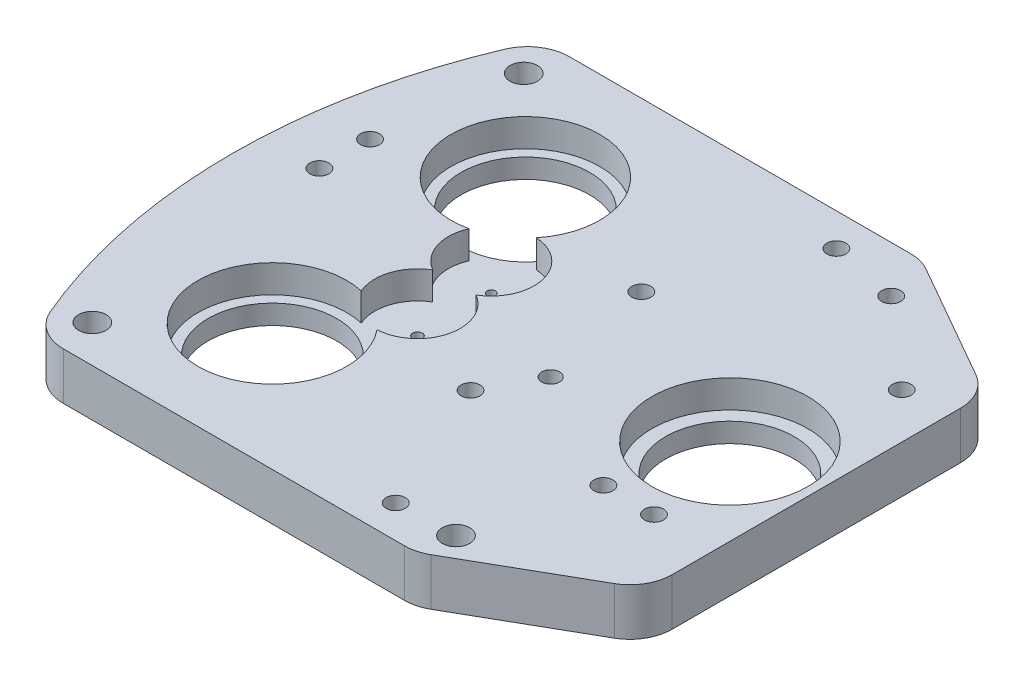
from build123d import *

# Parameters (mm, degrees)
SKETCH1_W                        = 125
SKETCH1_H                        = 120
TEST_BASE_POSTION_DEPTH          = 11.215
SKETCH10_R                       = 15.25
CONNECT_FINGER_HOLES_DEPTH       = 98.597363925
SKETCH11_R                       = 18.5
XL320_FINGER_KNUCKLE_MOUNT_DEPTH = 6.6025
SKETCH24_R                       = 2.25
AX12_MOUNT_HOLES_M4_DEPTH        = 98.597363925
SKETCH21_R                       = 17.65
SKETCH21_R_2                     = 10.15
GEARS_HOLES_DEPTH                = 6.6025
SKETCH22_R                       = 1.15
GEARS_ROD_HOLES_DEPTH            = 3
CUT_EXTRUDE1_DEPTH               = 98.597363925
FILLET1_R                        = 10
SKETCH17_R                       = 3.25
CONNECT_HOLES_M6_DEPTH           = 98.597363925
NUTS_M6_DEPTH                    = 6
NUTS_M4_DEPTH                    = 5
SKETCH30_R                       = 2.1
CONNECT_TO_HOUSE_DEPTH           = 98.597363925
SKETCH31_R                       = 2.25
M4_EXTENSION_HOLE_DEPTH          = 5
SKETCH28_R                       = 1
M2_SHAFT_HOLE_DEPTH              = 3


with BuildPart() as part:
    # Sketch1 → Test_Base_Postion (new body)
    with BuildSketch(Plane(origin=(0, 0, 0), x_dir=(1, 0, 0), z_dir=(0, 1, 0))):
        with BuildLine():
            ThreePointArc((-62.5, 60), (-76.154246239, 0), (-62.5, -60))
            Line((-62.5, -60), (-62.5, 60))
        make_face()
        Rectangle(SKETCH1_W, SKETCH1_H)
    extrude(amount=TEST_BASE_POSTION_DEPTH)

    # Sketch10 → Connect_Finger_Holes (cut, through all)
    with BuildSketch(Plane(origin=(0, 11.215, 0), x_dir=(1, 0, 0), z_dir=(0, 1, 0))):
        with Locations(Location((-36.5, 30, 0), (0, 0, 270))):
            Circle(SKETCH10_R)
        with Locations(Location((-36.5, -30, 0), (0, 0, 270))):
            Circle(SKETCH10_R)
        with Locations(Location((42, 0, 0), (0, 0, 270))):
            Circle(SKETCH10_R)
    extrude(amount=-CONNECT_FINGER_HOLES_DEPTH, mode=Mode.SUBTRACT)

    # Sketch11 → XL320_Finger_Knuckle_Mount (cut)
    with BuildSketch(Plane(origin=(0, 11.215, 0), x_dir=(1, 0, 0), z_dir=(0, 1, 0))):
        with Locations(Location((42, 0, 0), (0, 0, 270))):
            Circle(SKETCH11_R)
    extrude(amount=-XL320_FINGER_KNUCKLE_MOUNT_DEPTH, mode=Mode.SUBTRACT)

    # Sketch24 → AX12_Mount_Holes_(M4) (cut, through all)
    with BuildSketch(Plane(origin=(0, 11.215, 0), x_dir=(1, 0, 0), z_dir=(0, 1, 0))):
        with Locations(Location((15, 52.25, 0), (0, 0, 270))):
            Circle(SKETCH24_R)
        with Locations(Location((0.75, 20.25, 0), (0, 0, 270))):
            Circle(SKETCH24_R)
        with Locations(Location((0.75, -20.25, 0), (0, 0, 270))):
            Circle(SKETCH24_R)
        with Locations(Location((15, -52.25, 0), (0, 0, 270))):
            Circle(SKETCH24_R)
        with Locations(Location((51.75, 31, 0), (0, 0, 270))):
            Circle(SKETCH24_R)
        with Locations(Location((31.25, 49, 0), (0, 0, 270))):
            Circle(SKETCH24_R)
    extrude(amount=-AX12_MOUNT_HOLES_M4_DEPTH, mode=Mode.SUBTRACT)

    # Sketch21 → Gears_Holes (cut)
    with BuildSketch(Plane(origin=(0, 11.215, 0), x_dir=(1, 0, 0), z_dir=(0, 1, 0))):
        with Locations((-36.5, 30)):
            Circle(SKETCH21_R)
        with Locations((-23.330432809, 8.75)):
            Circle(SKETCH21_R_2)
        with Locations((-23.330432809, -8.75)):
            Circle(SKETCH21_R_2)
        with Locations((-36.5, -30)):
            Circle(SKETCH21_R)
    extrude(amount=-GEARS_HOLES_DEPTH, mode=Mode.SUBTRACT)

    # Sketch22 → Gears_Rod_Holes (cut)
    with BuildSketch(Plane(origin=(0, 4.6125, 0), x_dir=(1, 0, 0), z_dir=(0, 1, 0))):
        with Locations(Location((-23.330432809, -8.75, 0), (0, 0, 270))):
            Circle(SKETCH22_R)
    extrude(amount=-GEARS_ROD_HOLES_DEPTH, mode=Mode.SUBTRACT)

    # Sketch29 → Cut-Extrude1 (cut, through all)
    with BuildSketch(Plane(origin=(0, 11.215, 0), x_dir=(1, 0, 0), z_dir=(0, 1, 0))):
        Polygon((27.5, 60), (62.5, 40), (62.5, 60), align=None)
        Polygon((62.5, -60), (27.5, -60), (62.5, -40), align=None)
    extrude(amount=-CUT_EXTRUDE1_DEPTH, mode=Mode.SUBTRACT)

    # Fillet1
    fillet1_edges = [part.edges().sort_by_distance(p)[0] for p in [
        (27.5, 5.6075, -60),
        (62.5, 5.6075, -40),
        (62.5, 5.6075, 40),
        (27.5, 5.6075, 60),
        (-62.5, 5.6075, -60),
        (-62.5, 5.6075, 60),
    ]]
    fillet(fillet1_edges, radius=FILLET1_R)

    # Sketch17 → Connect_Holes_(M6) (cut, through all)
    with BuildSketch(Plane(origin=(0, 11.215, 0), x_dir=(1, 0, 0), z_dir=(0, 1, 0))):
        with Locations(Location((-58.040773893, 51.152938298, 0), (0, 0, 270))):
            Circle(SKETCH17_R)
        with Locations(Location((-58.040773893, -51.152938298, 0), (0, 0, 270))):
            Circle(SKETCH17_R)
        with Locations(Location((28.844355629, -51.794444289, 0), (0, 0, 270))):
            Circle(SKETCH17_R)
    extrude(amount=-CONNECT_HOLES_M6_DEPTH, mode=Mode.SUBTRACT)

    # Sketch19 → Nuts_(M6) (cut)
    with BuildSketch(Plane.XZ):
        Polygon((-58.040773893, 57.215116125), (-63.290773893, 54.184027211), (-63.290773893, 48.121849385), (-58.040773893, 45.090760472), (-52.790773893, 48.121849385), (-52.790773893, 54.184027211), align=None)
        Polygon((28.844355629, 45.732266462), (34.094355629, 48.763355375), (34.094355629, 54.825533202), (28.844355629, 57.856622115), (23.594355629, 54.825533202), (23.594355629, 48.763355375), align=None)
        Polygon((-63.290773893, -48.121849385), (-63.290773893, -54.184027211), (-58.040773893, -57.215116125), (-52.790773893, -54.184027211), (-52.790773893, -48.121849385), (-58.040773893, -45.090760472), align=None)
    extrude(amount=-NUTS_M6_DEPTH, mode=Mode.SUBTRACT)

    # Sketch27 → Nuts_(M4) (cut)
    with BuildSketch(Plane.XZ):
        Polygon((15, 56.580127019), (11.25, 54.415063509), (11.25, 50.084936491), (15, 47.919872981), (18.75, 50.084936491), (18.75, 54.415063509), align=None)
        Polygon((-3, 22.415063509), (-3, 18.084936491), (0.75, 15.919872981), (4.5, 18.084936491), (4.5, 22.415063509), (0.75, 24.580127019), align=None)
        Polygon((-3, -22.415063509), (0.75, -24.580127019), (4.5, -22.415063509), (4.5, -18.084936491), (0.75, -15.919872981), (-3, -18.084936491), align=None)
        Polygon((11.25, -50.084936491), (11.25, -54.415063509), (15, -56.580127019), (18.75, -54.415063509), (18.75, -50.084936491), (15, -47.919872981), align=None)
        Polygon((55.5, -28.834936491), (51.75, -26.669872981), (48, -28.834936491), (48, -33.165063509), (51.75, -35.330127019), (55.5, -33.165063509), align=None)
        Polygon((27.5, -46.834936491), (27.5, -51.165063509), (31.25, -53.330127019), (35, -51.165063509), (35, -46.834936491), (31.25, -44.669872981), align=None)
    extrude(amount=-NUTS_M4_DEPTH, mode=Mode.SUBTRACT)

    # Sketch30 → Connect_To_House (cut, through all)
    with BuildSketch(Plane(origin=(0, 11.215, 0), x_dir=(1, 0, 0), z_dir=(0, 1, 0))):
        with Locations(Location((7.5, -8, 0), (0, 0, 270))):
            Circle(SKETCH30_R)
    extrude(amount=-CONNECT_TO_HOUSE_DEPTH, mode=Mode.SUBTRACT)

    # Sketch31 → M4_Extension_Hole (cut)
    with BuildSketch(Plane(origin=(0, 11.215, 0), x_dir=(1, 0, 0), z_dir=(0, 1, 0))):
        with Locations(Location((-62.75, 19.41386581, 0), (0, 0, 270))):
            Circle(SKETCH31_R)
        with Locations(Location((-62.75, 7.41386581, 0), (0, 0, 270))):
            Circle(SKETCH31_R)
        with Locations(Location((36, -24, 0), (0, 0, 270))):
            Circle(SKETCH31_R)
        with Locations(Location((48, -24, 0), (0, 0, 270))):
            Circle(SKETCH31_R)
    extrude(amount=-M4_EXTENSION_HOLE_DEPTH, mode=Mode.SUBTRACT)

    # Sketch28 → M2_Shaft_Hole (cut)
    with BuildSketch(Plane(origin=(0, 4.6125, 0), x_dir=(1, 0, 0), z_dir=(0, 1, 0))):
        with Locations(Location((-23.330432809, 8.75, 0), (0, 0, 270))):
            Circle(SKETCH28_R)
    extrude(amount=-M2_SHAFT_HOLE_DEPTH, mode=Mode.SUBTRACT)


solid = part.part
